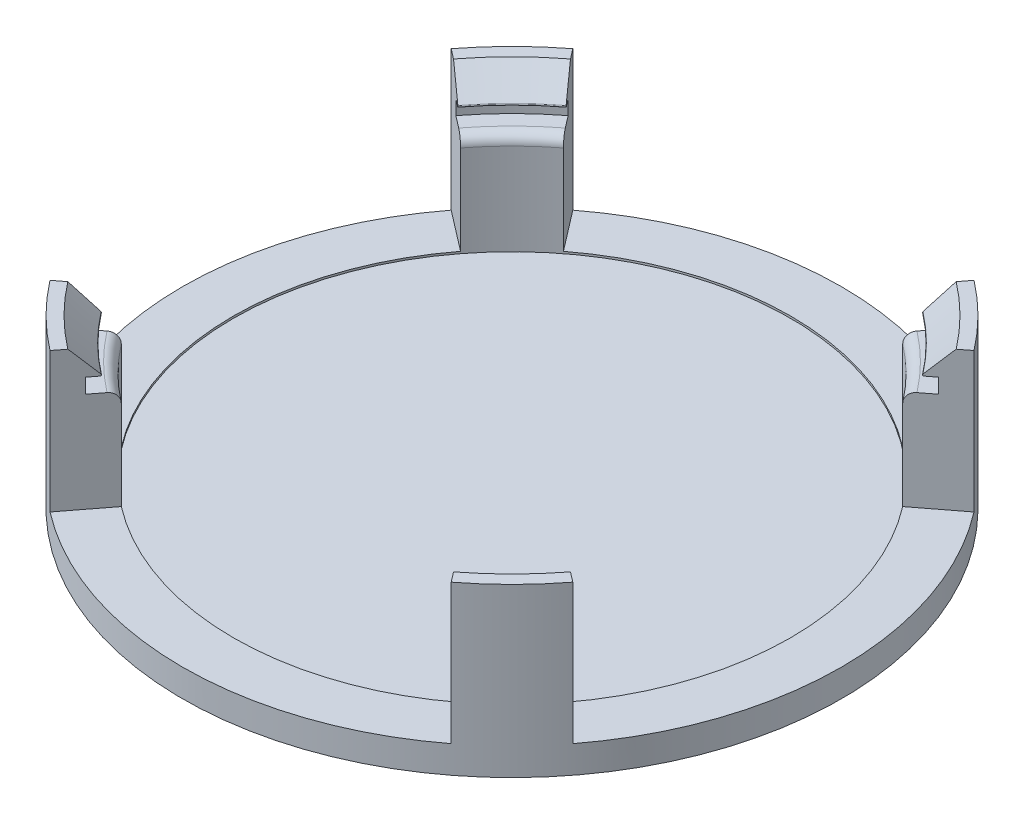
from build123d import *

# Parameters (mm, degrees)
CUT_EXTRUDE3_DEPTH = 17.4625
FILLET1_R          = 0.127
FILLET2_R          = 1.27


with BuildPart() as part:
    # Sketch1 → Revolve1 (revolve)
    with BuildSketch(Plane.XY):
        Polygon((0, 0), (-41.148, 0), (-41.148, 20.8915), (-39.5605, 20.8915), (-36.3855, 17.7165), (-37.973, 17.7165), (-37.973, 15.875), (-34.798, 15.875), (-34.798, 3.175), (0, 3.175), align=None)
    revolve(axis=Axis((0, 3.175, 0), (0, -1, 0)))

    # Sketch2 → Cut-Extrude3 (cut)
    with BuildSketch(Plane(origin=(0, 20.8915, 0), x_dir=(1, 0, 0), z_dir=(0, 1, 0))):
        with BuildLine():
            Line((-24.082906512, 31.385454819), (0, 0))
            Line((0, 0), (24.082906512, 31.385454819))
            ThreePointArc((24.082906512, 31.385454819), (0, 39.5605), (-24.082906512, 31.385454819))
        make_face()
        with BuildLine():
            Line((-25.049315281, 32.644903246), (-24.082906512, 31.385454819))
            ThreePointArc((-24.082906512, 31.385454819), (0, 39.5605), (24.082906512, 31.385454819))
            Line((24.082906512, 31.385454819), (25.049315281, 32.644903246))
            ThreePointArc((25.049315281, 32.644903246), (0, 41.148), (-25.049315281, 32.644903246))
        make_face()
        with BuildLine():
            Line((31.385454819, 24.082906512), (0, 0))
            Line((0, 0), (31.385454819, -24.082906512))
            ThreePointArc((31.385454819, -24.082906512), (37.461029388, -12.716305967), (39.5605, 0))
            ThreePointArc((39.5605, 0), (37.461029388, 12.716305967), (31.385454819, 24.082906512))
        make_face()
        with BuildLine():
            Line((32.644903246, 25.049315281), (31.385454819, 24.082906512))
            ThreePointArc((31.385454819, 24.082906512), (37.461029388, 12.716305967), (39.5605, 0))
            ThreePointArc((39.5605, 0), (37.461029388, -12.716305967), (31.385454819, -24.082906512))
            Line((31.385454819, -24.082906512), (32.644903246, -25.049315281))
            ThreePointArc((32.644903246, -25.049315281), (38.964280968, -13.226591118), (41.148, 0))
            ThreePointArc((41.148, 0), (38.964280968, 13.226591118), (32.644903246, 25.049315281))
        make_face()
        with BuildLine():
            Line((24.082906512, -31.385454819), (0, 0))
            Line((0, 0), (-24.082906512, -31.385454819))
            ThreePointArc((-24.082906512, -31.385454819), (0, -39.5605), (24.082906512, -31.385454819))
        make_face()
        with BuildLine():
            Line((25.049315281, -32.644903246), (24.082906512, -31.385454819))
            ThreePointArc((24.082906512, -31.385454819), (0, -39.5605), (-24.082906512, -31.385454819))
            Line((-24.082906512, -31.385454819), (-25.049315281, -32.644903246))
            ThreePointArc((-25.049315281, -32.644903246), (0, -41.148), (25.049315281, -32.644903246))
        make_face()
        with BuildLine():
            Line((0, 0), (-32.644903246, 25.049315281))
            ThreePointArc((-32.644903246, 25.049315281), (-41.148, 0), (-32.644903246, -25.049315281))
            Line((-32.644903246, -25.049315281), (0, 0))
        make_face()
    extrude(amount=-CUT_EXTRUDE3_DEPTH, mode=Mode.SUBTRACT)

    # Fillet1
    fillet1_edges = [part.edges().sort_by_distance(p)[0] for p in [
        (25.728433787, 17.7165, -25.728433787),
        (25.728433787, 17.7165, 25.728433787),
        (-25.728433787, 17.7165, 25.728433787),
        (-25.728433787, 17.7165, -25.728433787),
    ]]
    fillet(fillet1_edges, radius=FILLET1_R)

    # Fillet2
    fillet2_edges = [part.edges().sort_by_distance(p)[0] for p in [
        (24.605901772, 15.875, -24.605901772),
        (24.605901772, 15.875, 24.605901772),
        (-24.605901772, 15.875, 24.605901772),
        (-24.605901772, 15.875, -24.605901772),
    ]]
    fillet(fillet2_edges, radius=FILLET2_R)


solid = part.part
